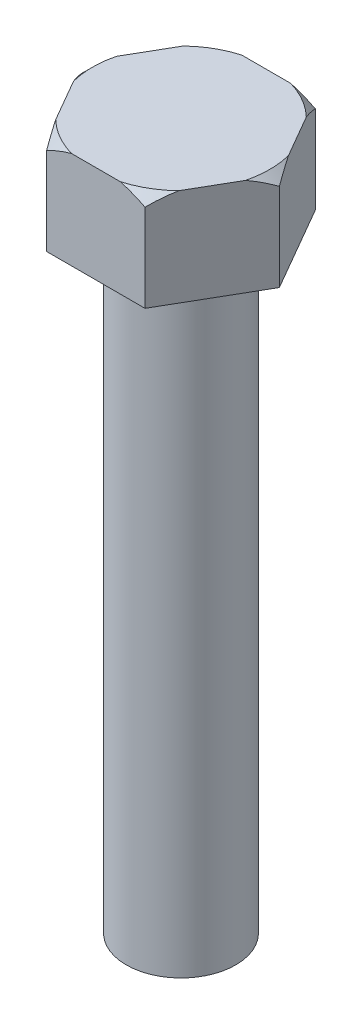
from build123d import *

# Parameters (mm, degrees)
SKETCH1_R           = 2.25
BOSS_EXTRUDE1_DEPTH = 25
SKETCH2_R           = 2.25
BOSS_EXTRUDE2_DEPTH = 4


with BuildPart() as part:
    # Sketch1 → Boss-Extrude1 (new body)
    with BuildSketch(Plane(origin=(0, 0, 0), x_dir=(1, 0, 0), z_dir=(0, 1, 0))):
        with Locations(Location((0, 0, 0), (0, 0, 270))):
            Circle(SKETCH1_R)
    extrude(amount=BOSS_EXTRUDE1_DEPTH)

    # Sketch2 → Boss-Extrude2 (add)
    with BuildSketch(Plane(origin=(0, 25, 0), x_dir=(1, 0, 0), z_dir=(0, 1, 0))):
        with Locations(Location((0, 0, 0), (0, 0, 270))):
            Circle(SKETCH2_R)
        Polygon((-4.041451884, 0), (4.041451884, 0), (2.020725942, 3.5), (-2.020725942, 3.5), align=None)
        Polygon((-2.020725942, -3.5), (2.020725942, -3.5), (4.041451884, 0), (-4.041451884, 0), align=None)
        with BuildLine():
            ThreePointArc((-2.25, 0), (0, -2.25), (2.25, 0))
            Line((2.25, 0), (-2.25, 0))
        make_face()
        with BuildLine():
            Line((-2.25, 0), (2.25, 0))
            ThreePointArc((2.25, 0), (0, 2.25), (-2.25, 0))
        make_face()
    extrude(amount=BOSS_EXTRUDE2_DEPTH)

    # Sketch5 → Cut-Revolve1 (revolve, cut)
    with BuildSketch(Plane.XY):
        Polygon((3.641451884, 29), (4.041451884, 29), (4.041451884, 28.6), align=None)
    revolve(axis=Axis((0, 29, 0), (0, -1, 0)), mode=Mode.SUBTRACT)


solid = part.part
